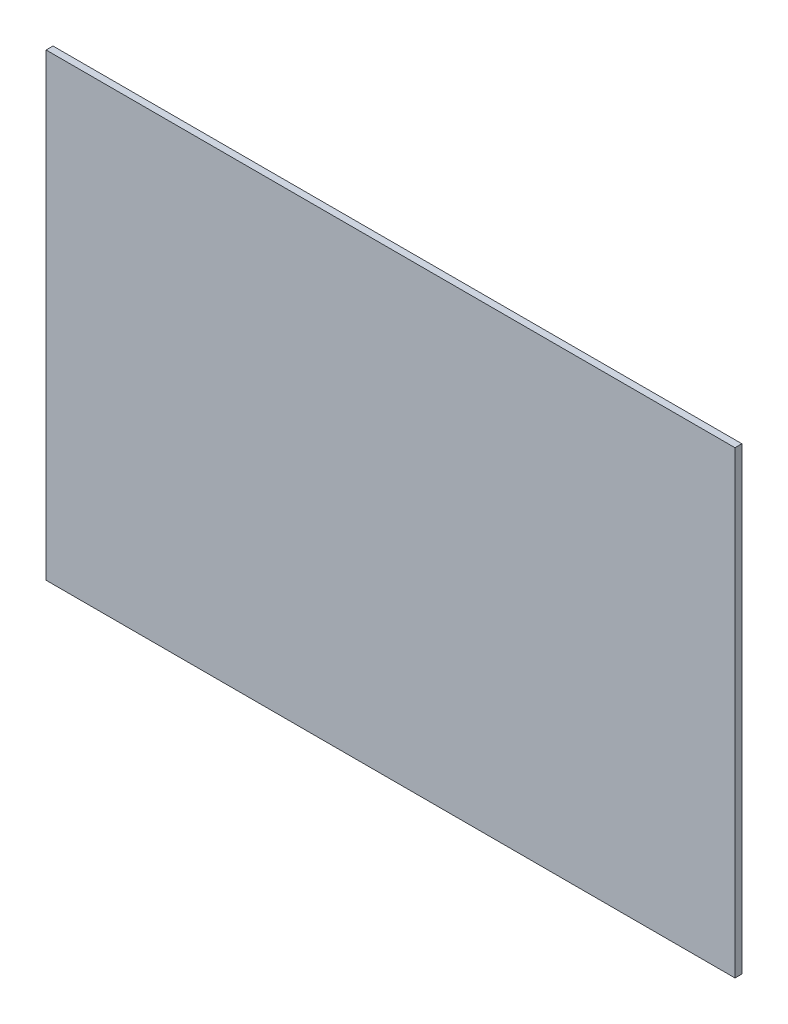
from build123d import *

# Parameters (mm, degrees)
ESBO_O1_W                = 600
ESBO_O1_H                = 400
RESSALTO_EXTRUS_O1_DEPTH = 6


with BuildPart() as part:
    # Esboço1 → Ressalto-extrusão1 (new body)
    with BuildSketch(Plane.XY):
        with Locations((300, 200)):
            Rectangle(ESBO_O1_W, ESBO_O1_H)
    extrude(amount=RESSALTO_EXTRUS_O1_DEPTH)


solid = part.part
